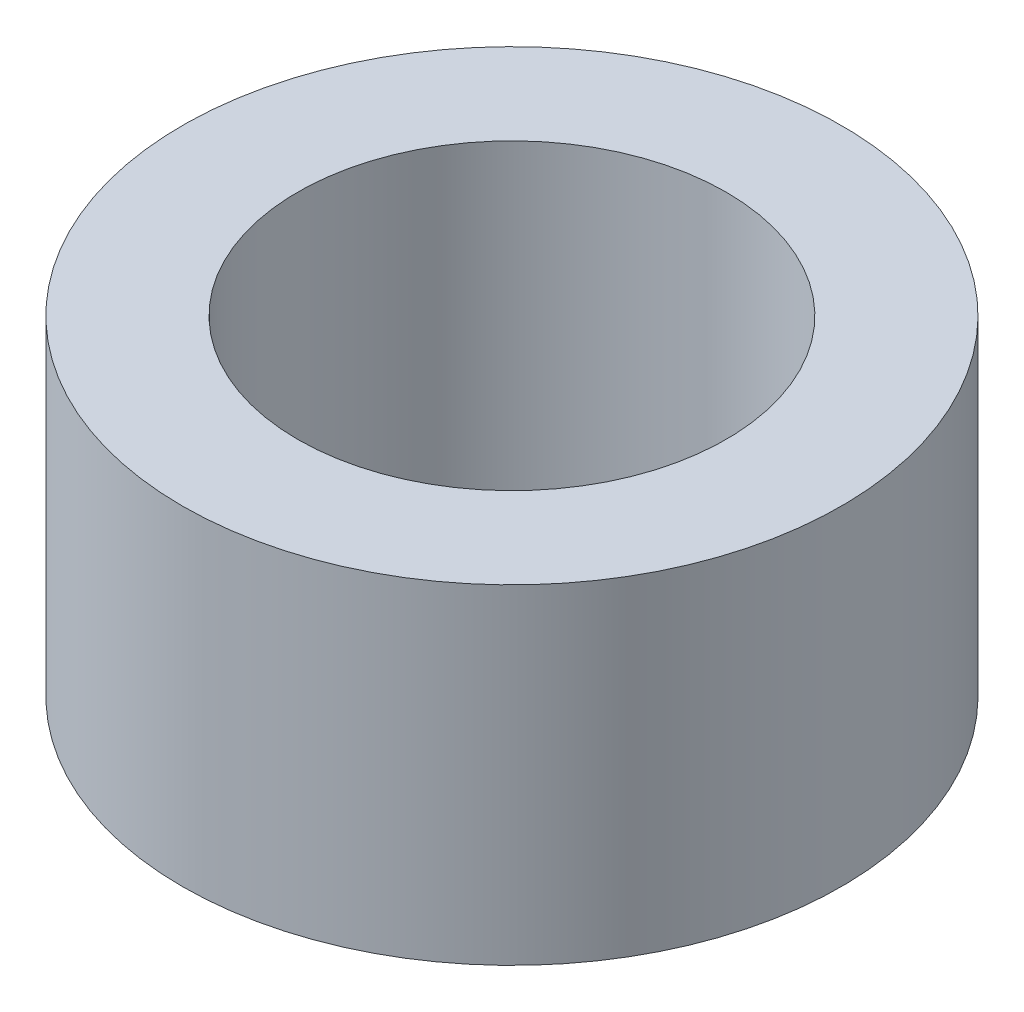
from build123d import *

# Parameters (mm, degrees)
SKETCH1_R           = 5
SKETCH1_R_2         = 3.25
BOSS_EXTRUDE1_DEPTH = 5


with BuildPart() as part:
    # Sketch1 → Boss-Extrude1 (new body)
    with BuildSketch(Plane(origin=(0, 0, 0), x_dir=(1, 0, 0), z_dir=(0, 1, 0))):
        with Locations(Location((0, 0, 0), (0, 0, 270))):
            Circle(SKETCH1_R)
        with Locations(Location((0, 0, 0), (0, 0, 270))):
            Circle(SKETCH1_R_2, mode=Mode.SUBTRACT)
    extrude(amount=BOSS_EXTRUDE1_DEPTH)


solid = part.part
